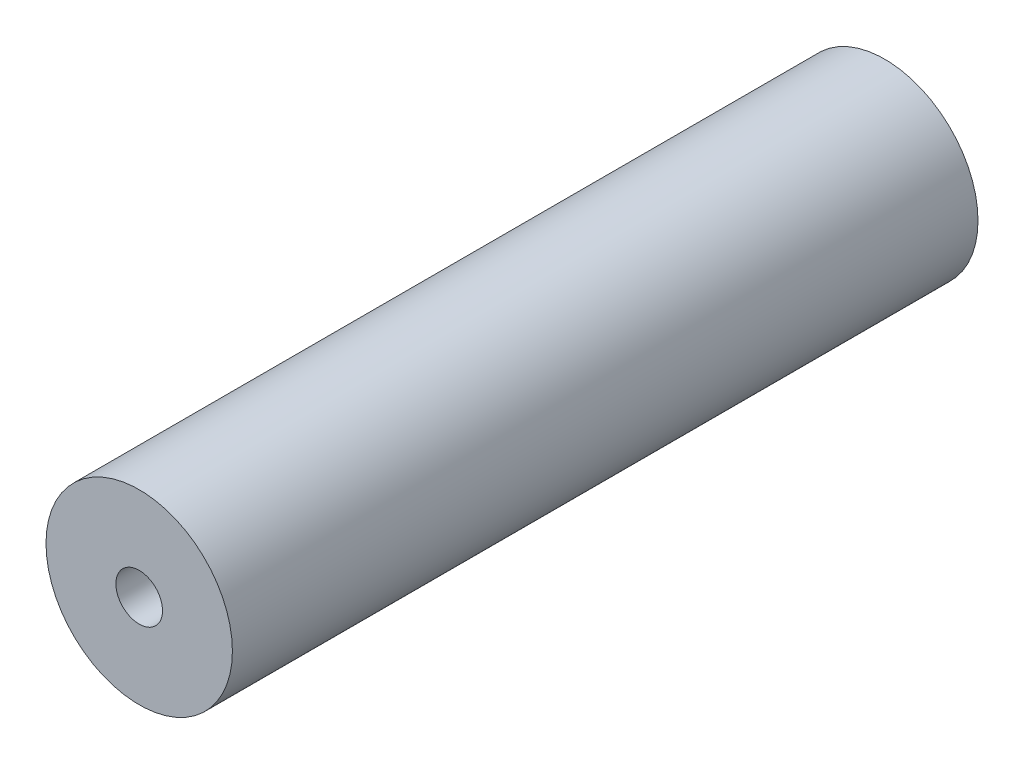
from build123d import *

# Parameters (mm, degrees)
SKETCH1_R           = 25.4
BOSS_EXTRUDE1_DEPTH = 203.2
SKETCH2_R           = 6.35
CUT_EXTRUDE1_DEPTH  = 207.350575478


with BuildPart() as part:
    # Sketch1 → Boss-Extrude1 (new body)
    with BuildSketch(Plane.XY):
        Circle(SKETCH1_R)
    extrude(amount=BOSS_EXTRUDE1_DEPTH)

    # Sketch2 → Cut-Extrude1 (cut, through all)
    with BuildSketch(Plane.XY.offset(203.2)):
        Circle(SKETCH2_R)
    extrude(amount=-CUT_EXTRUDE1_DEPTH, mode=Mode.SUBTRACT)


solid = part.part
